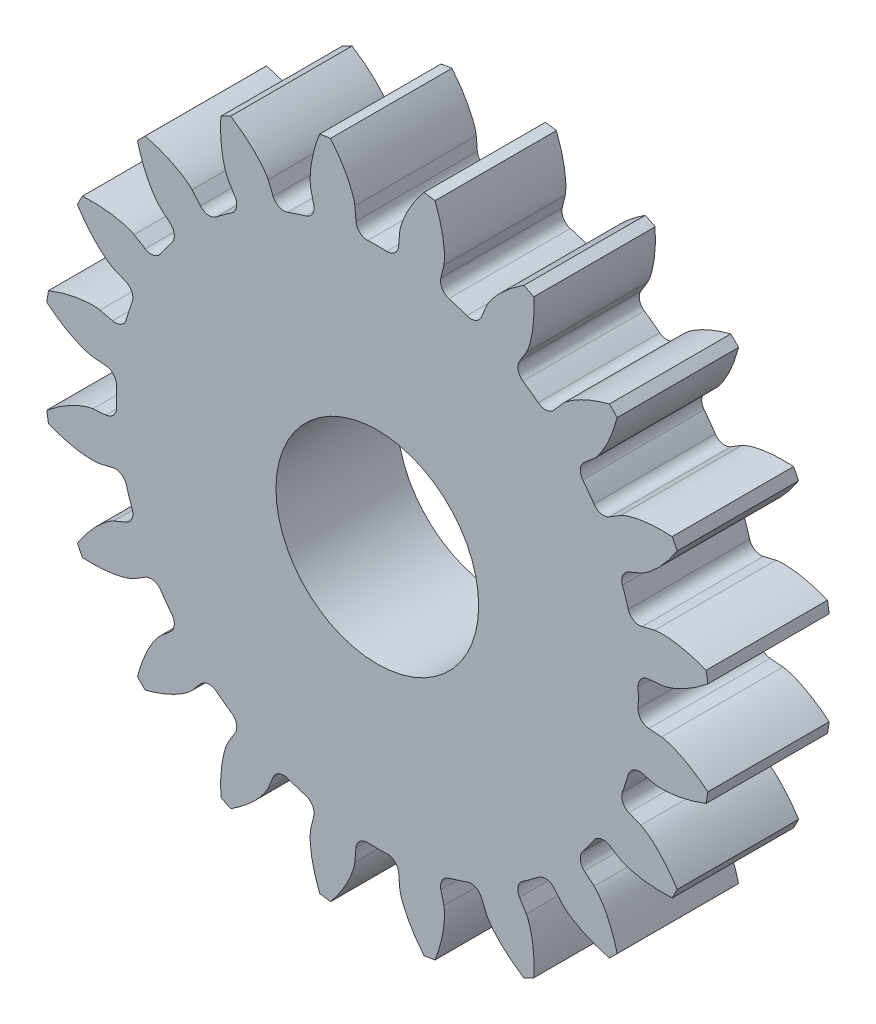
from build123d import *

# Parameters (mm, degrees)
BLANK_SKETCH_R    = 13.75
BLANK_DEPTH       = 5
TOOTH_SPACE_DEPTH = 21.077973005
TEETH_COUNT       = 20
BORE_DEPTH        = 20.892459281
BORE_DEPTH_BACK   = 20.892459281
BORE_SKETCH_R     = 4.175


with BuildPart() as part:
    # Blank Sketch → Blank (new body)
    with BuildSketch(Plane.XY):
        Circle(BLANK_SKETCH_R)
    extrude(amount=BLANK_DEPTH)

    # Tooth Space Sketch → Tooth Space (cut, symmetric)
    with BuildSketch(Plane.XY):
        with BuildLine():
            Line((11.709860103, 0.922712572), (11.180289267, 0.880983494))
            ThreePointArc((11.180289267, 0.880983494), (10.862988941, 0.723480031), (10.742915644, 0.39020951))
            ThreePointArc((10.742915644, 0.39020951), (10.75, 0), (10.742915644, -0.39020951))
            ThreePointArc((10.742915644, -0.39020951), (10.862988941, -0.723480031), (11.180289267, -0.880983494))
            Line((11.180289267, -0.880983494), (11.709860103, -0.922712572))
            add(Edge.make_bspline(
                [(11.709860103, -0.922712572), (11.715313475, -0.923234617), (11.730580069, -0.924982426), (11.759319753, -0.929405731), (11.80598663, -0.938205714), (11.86506971, -0.951736167), (11.94092317, -0.971871237), (12.029548412, -0.998976801), (12.126085986, -1.032288866), (12.230093072, -1.072304199), (12.332879138, -1.115538905), (12.434437251, -1.161726096), (12.534681177, -1.210479105), (12.654945734, -1.272744636), (12.797491556, -1.351852601), (12.961497116, -1.450701421), (13.144282968, -1.570278326), (13.326873882, -1.699980424), (13.503420438, -1.834000155), (13.677968733, -1.976594979), (13.844122091, -2.119647646), (14.012499078, -2.275384766), (14.16579995, -2.422795632), (14.332640843, -2.595647481), (14.46587003, -2.737409714), (14.599233693, -2.890118061), (14.663505795, -2.96535919), (14.69608147, -3.004195304)],
                knots=[0, 0, 0, 0, 0, 0.005376749, 0.015083688, 0.02853182, 0.046610139, 0.064854849, 0.092110525, 0.119476176, 0.146842496, 0.174208854, 0.201574956, 0.228941013, 0.256307345, 0.307035032, 0.361767352, 0.41649966, 0.471231936, 0.525964282, 0.580696615, 0.635428982, 0.690161387, 0.744893688, 0.799626082, 0.854358408, 0.909090915, 0.909090915, 0.909090915, 0.909090915, 0.909090915], degree=4))
            Line((14.69608147, -3.004195304), (14.69608147, 3.004195304))
            add(Edge.make_bspline(
                [(11.709860103, 0.922712572), (11.715313475, 0.923234617), (11.730580069, 0.924982426), (11.759319753, 0.929405731), (11.80598663, 0.938205714), (11.86506971, 0.951736167), (11.94092317, 0.971871237), (12.029548412, 0.998976801), (12.126085986, 1.032288866), (12.230093072, 1.072304199), (12.332879138, 1.115538905), (12.434437251, 1.161726096), (12.534681177, 1.210479105), (12.654945734, 1.272744636), (12.797491556, 1.351852601), (12.961497116, 1.450701421), (13.144282968, 1.570278326), (13.326873882, 1.699980424), (13.503420438, 1.834000155), (13.677968733, 1.976594979), (13.844122091, 2.119647646), (14.012499078, 2.275384766), (14.16579995, 2.422795632), (14.332640843, 2.595647481), (14.46587003, 2.737409714), (14.599233693, 2.890118061), (14.663505795, 2.96535919), (14.69608147, 3.004195304)],
                knots=[0, 0, 0, 0, 0, 0.005376749, 0.015083688, 0.02853182, 0.046610139, 0.064854849, 0.092110525, 0.119476176, 0.146842496, 0.174208854, 0.201574956, 0.228941013, 0.256307345, 0.307035032, 0.361767352, 0.41649966, 0.471231936, 0.525964282, 0.580696615, 0.635428982, 0.690161387, 0.744893688, 0.799626082, 0.854358408, 0.909090915, 0.909090915, 0.909090915, 0.909090915, 0.909090915], degree=4))
        make_face()
    tooth_space = extrude(amount=TOOTH_SPACE_DEPTH, both=True, mode=Mode.SUBTRACT)

    # Teeth: Tooth Space ×20 about axis
    teeth_axis = Axis((0, 0, -0.25007105), (0, 0, 1))
    for i in range(1, TEETH_COUNT):
        add(tooth_space.rotate(teeth_axis, i * 360 / TEETH_COUNT), mode=Mode.SUBTRACT)

    # Bore Sketch → Bore (cut, two sides: drawn at the far end of the back side and taken through both)
    with BuildSketch(Plane.XY.offset(-BORE_DEPTH_BACK)):
        Circle(BORE_SKETCH_R)
    extrude(amount=BORE_DEPTH + BORE_DEPTH_BACK, mode=Mode.SUBTRACT)


solid = part.part
